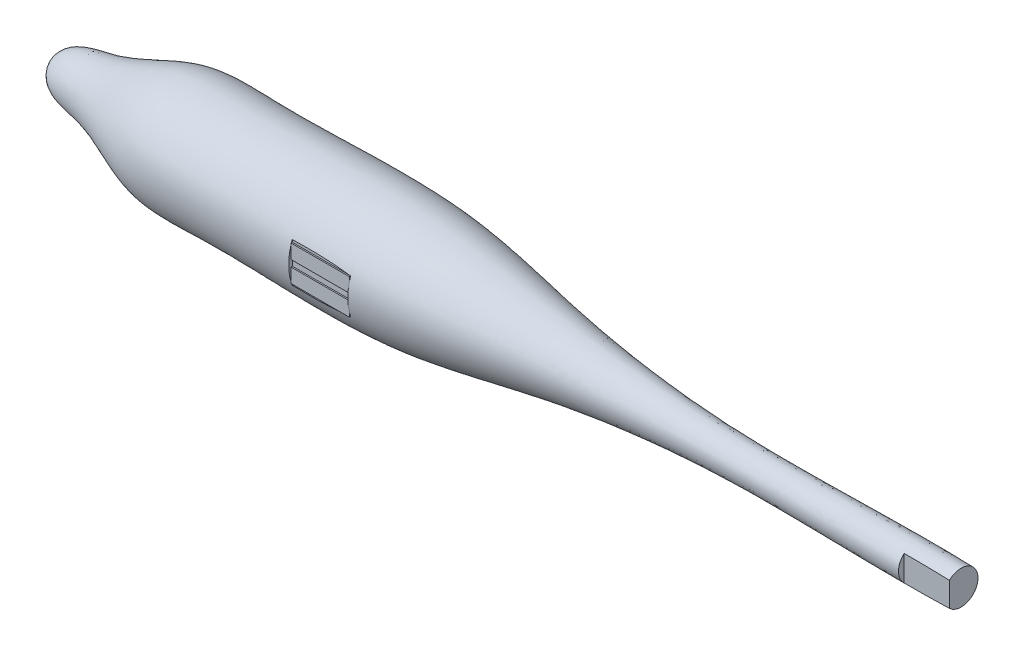
from build123d import *

# Parameters (mm, degrees)
SKETCH7_W           = 70
SKETCH7_H           = 50
CUT_EXTRUDE3_DEPTH  = 70
SKETCH5_W           = 90
SKETCH5_H           = 200
CUT_EXTRUDE4_DEPTH  = 6.5
SKETCH8_W           = 90
SKETCH8_H           = 22.045196906
BOSS_EXTRUDE1_DEPTH = 2


with BuildPart() as part:
    # Sketch1 → Revolve2 (revolve)
    with BuildSketch(Plane.XY):
        with BuildLine():
            Line((0, 0), (1400, 0))
            Line((1400, 0), (1400, 25.997014576))
            add(Edge.make_bspline(
                [(0, 0), (6.007862839, 35.12054136), (87.570445438, 35.979993634), (174.285504865, 89.884927882), (355.229810131, 80.463468301), (551.199038272, 98.190296267), (802.566829119, 43.065619564), (1072.41205954, 17.747902618), (1281.149711777, 28.859320036), (1400, 25.997014576)],
                knots=[0, 0, 0, 0, 0.060908752, 0.147322495, 0.213188607, 0.431416814, 0.561861324, 0.750119802, 1, 1, 1, 1], degree=3))
        make_face()
    revolve(axis=Axis((0, 0, 0), (1, 0, 0)))

    # Sketch7 → Cut-Extrude3 (cut)
    with BuildSketch(Plane.XY.offset(88)):
        with Locations((1365.10148425, 0)):
            Rectangle(SKETCH7_W, SKETCH7_H)
    extrude(amount=-CUT_EXTRUDE3_DEPTH, mode=Mode.SUBTRACT)

    # Sketch5 → Cut-Extrude4 (cut)
    with BuildSketch(Plane.XY.offset(88)):
        with Locations((495, 0)):
            Rectangle(SKETCH5_W, SKETCH5_H)
    extrude(amount=-CUT_EXTRUDE4_DEPTH, mode=Mode.SUBTRACT)

    # Sketch8 → Boss-Extrude1 (add)
    with BuildSketch(Plane.XY.offset(81.5)):
        with Locations((495, 16.022598453)):
            Rectangle(SKETCH8_W, SKETCH8_H)
        with Locations((495, -16.022598453)):
            Rectangle(SKETCH8_W, SKETCH8_H)
    extrude(amount=BOSS_EXTRUDE1_DEPTH)


solid = part.part
